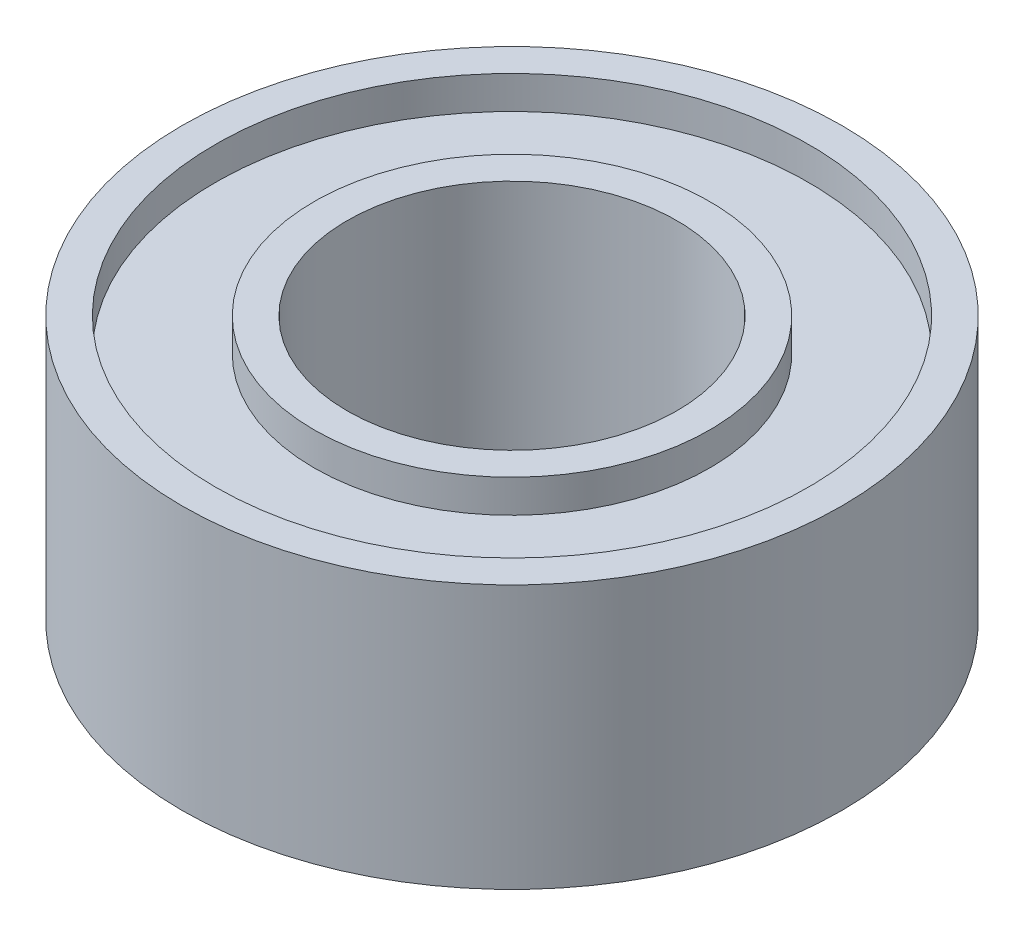
from build123d import *

# Parameters (mm, degrees)
SKETCH1_R           = 5
SKETCH1_R_2         = 2.5
BOSS_EXTRUDE1_DEPTH = 4
SKETCH2_R           = 4.5
SKETCH2_R_2         = 3
CUT_EXTRUDE1_DEPTH  = 0.5
CUT_EXTRUDE2_START  = -0.5
SKETCH3_R           = 4.5
SKETCH3_R_2         = 3
CUT_EXTRUDE2_DEPTH  = 0.5


with BuildPart() as part:
    # Sketch1 → Boss-Extrude1 (new body)
    with BuildSketch(Plane(origin=(0, 0, 0), x_dir=(1, 0, 0), z_dir=(0, 1, 0))):
        with Locations(Location((0, 0, 0), (0, 0, 270))):
            Circle(SKETCH1_R)
        with Locations(Location((0, 0, 0), (0, 0, 270))):
            Circle(SKETCH1_R_2, mode=Mode.SUBTRACT)
    extrude(amount=BOSS_EXTRUDE1_DEPTH)

    # Sketch2 → Cut-Extrude1 (cut)
    with BuildSketch(Plane(origin=(0, 4, 0), x_dir=(1, 0, 0), z_dir=(0, 1, 0))):
        with Locations(Location((0, 0, 0), (0, 0, 270))):
            Circle(SKETCH2_R)
        with Locations(Location((0, 0, 0), (0, 0, 270))):
            Circle(SKETCH2_R_2, mode=Mode.SUBTRACT)
    extrude(amount=-CUT_EXTRUDE1_DEPTH, mode=Mode.SUBTRACT)

    # Sketch3 → Cut-Extrude2 (cut)
    with BuildSketch(Plane.XZ.offset(CUT_EXTRUDE2_START)):
        with Locations(Location((0, 0, 0), (0, 0, 90))):
            Circle(SKETCH3_R)
        with Locations(Location((0, 0, 0), (0, 0, 90))):
            Circle(SKETCH3_R_2, mode=Mode.SUBTRACT)
    extrude(amount=CUT_EXTRUDE2_DEPTH, mode=Mode.SUBTRACT)


solid = part.part
